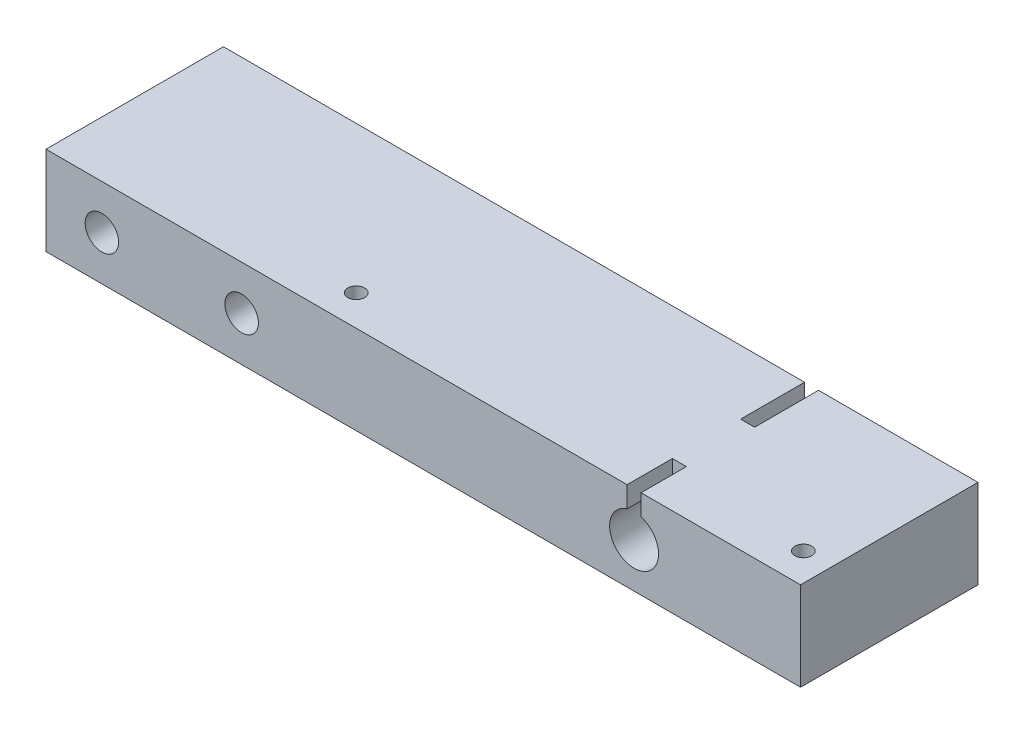
from build123d import *

# Parameters (mm, degrees)
SKETCH1_W           = 54
SKETCH1_H           = 6.35
BOSS_EXTRUDE1_DEPTH = 12.7
SKETCH3_W           = 1
SKETCH3_H           = 3.243111396
SKETCH3_H_2         = 4.577374163
CUT_EXTRUDE1_DEPTH  = 2
SKETCH4_R           = 1.75
CUT_EXTRUDE2_DEPTH  = 56.835584532
SKETCH5_R           = 0.6
CUT_EXTRUDE3_DEPTH  = 56.835584532
SKETCH6_R           = 1.2
CUT_EXTRUDE4_DEPTH  = 56.835584532
SKETCH12_R          = 0.6
CUT_EXTRUDE6_DEPTH  = 15


with BuildPart() as part:
    # Sketch1 → Boss-Extrude1 (new body)
    with BuildSketch(Plane.XY):
        with Locations((27, 3.175)):
            Rectangle(SKETCH1_W, SKETCH1_H)
    extrude(amount=BOSS_EXTRUDE1_DEPTH)

    # Sketch3 → Cut-Extrude1 (cut)
    with BuildSketch(Plane(origin=(0, 6.35, 0), x_dir=(1, 0, 0), z_dir=(0, 1, 0))):
        with Locations((42.087715046, -11.078444302)):
            Rectangle(SKETCH3_W, SKETCH3_H)
        with Locations((42.087715046, -2.288687081)):
            Rectangle(SKETCH3_W, SKETCH3_H_2)
    extrude(amount=-CUT_EXTRUDE1_DEPTH, mode=Mode.SUBTRACT)

    # Sketch4 → Cut-Extrude2 (cut, through all)
    with BuildSketch(Plane.XY.offset(12.7)):
        with Locations(Location((42.087715046, 3.175, 0), (0, 0, 73.398450401))):
            Circle(SKETCH4_R)
    extrude(amount=-CUT_EXTRUDE2_DEPTH, mode=Mode.SUBTRACT)

    # Sketch5 → Cut-Extrude3 (cut, through all)
    with BuildSketch(Plane(origin=(0, 6.35, 0), x_dir=(1, 0, 0), z_dir=(0, 1, 0))):
        with Locations(Location((52, -10.5, 0), (0, 0, 270))):
            Circle(SKETCH5_R)
        with Locations(Location((20, -10.5, 0), (0, 0, 270))):
            Circle(SKETCH5_R)
    extrude(amount=-CUT_EXTRUDE3_DEPTH, mode=Mode.SUBTRACT)

    # Sketch6 → Cut-Extrude4 (cut, through all)
    with BuildSketch(Plane.XY.offset(12.7)):
        with Locations((4, 3.175)):
            Circle(SKETCH6_R)
        with Locations((14, 3.175)):
            Circle(SKETCH6_R)
    extrude(amount=-CUT_EXTRUDE4_DEPTH, mode=Mode.SUBTRACT)

    # Sketch12 → Cut-Extrude6 (cut)
    with BuildSketch(Plane(origin=(25.944559134, 0, 23.885086629), x_dir=(-0.677303634830695, 0, 0.7357035994509805), z_dir=(-0.7357035994509805, 0, -0.677303634830695))):
        with Locations(Location((-22.399423471, 2.211286905, 0), (0, 0, 180))):
            Circle(SKETCH12_R)
    extrude(amount=CUT_EXTRUDE6_DEPTH, mode=Mode.SUBTRACT)


solid = part.part
